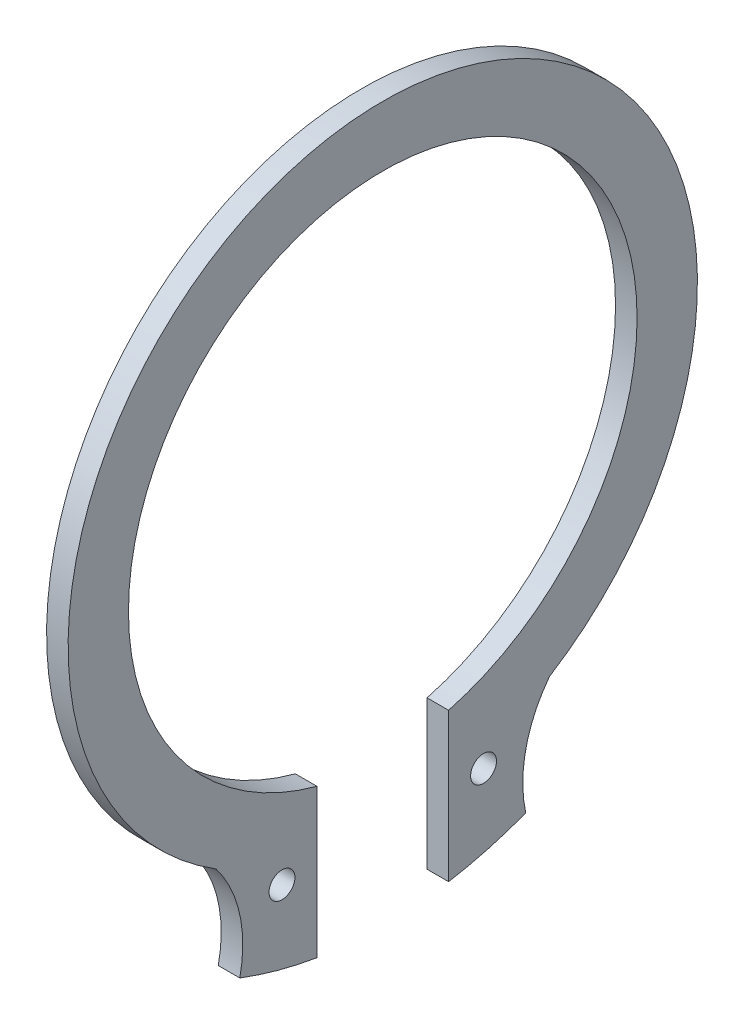
from build123d import *

# Parameters (mm, degrees)
ESQUISSE1_R        = 1.5
BOSS_EXTRU_1_DEPTH = 2.5


with BuildPart() as part:
    # Esquisse1 → Boss.-Extru.1 (new body)
    with BuildSketch(Plane(origin=(0, 0, 0), x_dir=(0, 0, -1), z_dir=(1, 0, 0))):
        with BuildLine():
            Line((-7.635161831, -28.494811876), (-7.635161831, -45.716810954))
            ThreePointArc((-7.635161831, -45.716810954), (-12.171135945, -44.723438484), (-16.584953257, -43.281194825))
            ThreePointArc((-16.584953257, -43.281194825), (-16.601338521, -36.814744165), (-19.338345955, -30.95607171))
            ThreePointArc((-19.338345955, -30.95607171), (0, 36.5), (19.338345955, -30.95607171))
            ThreePointArc((19.338345955, -30.95607171), (16.601338521, -36.814744165), (16.584953257, -43.281194825))
            ThreePointArc((16.584953257, -43.281194825), (12.171135945, -44.723438484), (7.635161831, -45.716810954))
            Line((7.635161831, -45.716810954), (7.635161831, -28.494811876))
            ThreePointArc((7.635161831, -28.494811876), (0, 29.5), (-7.635161831, -28.494811876))
        make_face()
        with Locations((-11.690226283, -36.364268867)):
            Circle(ESQUISSE1_R, mode=Mode.SUBTRACT)
        with Locations(Location((11.690226283, -36.364268867, 0), (0, 0, 180))):
            Circle(ESQUISSE1_R, mode=Mode.SUBTRACT)
    extrude(amount=BOSS_EXTRU_1_DEPTH)


solid = part.part
